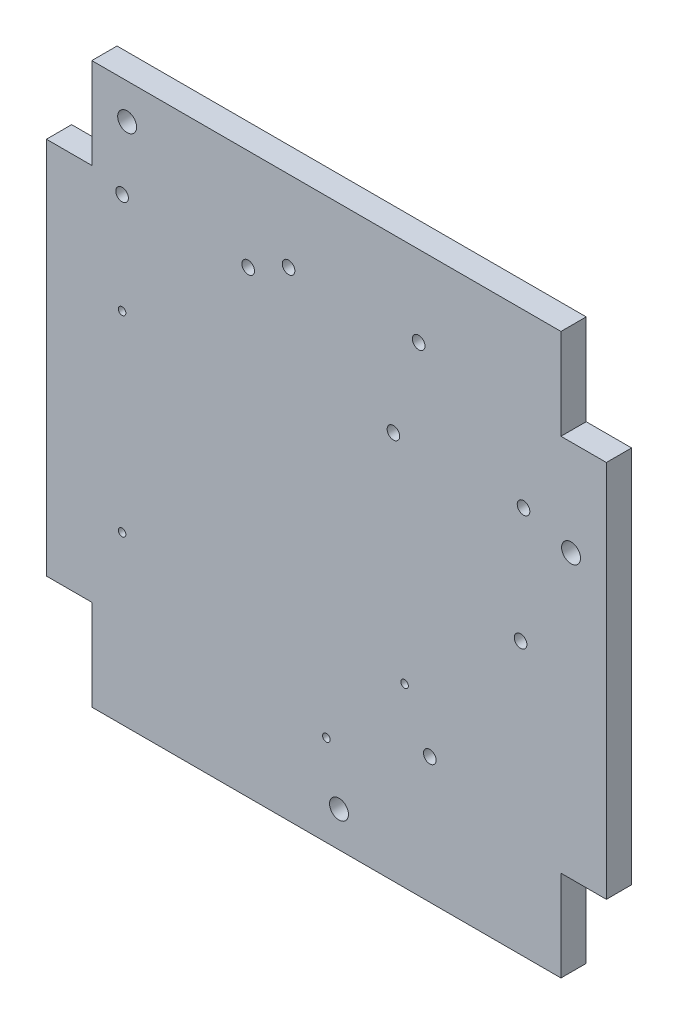
from build123d import *

# Parameters (mm, degrees)
SZKIC2_R                    = 0.75
SZKIC2_R_2                  = 1.875
SZKIC2_R_3                  = 1.25
DODANIE_WYCI_GNI_CIE1_DEPTH = 5


with BuildPart() as part:
    # Szkic2 → Dodanie-wyciągnięcie1 (new body)
    with BuildSketch(Plane.XY):
        Polygon((9, 18), (9, 0), (102, 0), (102, 18), (111, 18), (111, 93), (102, 93), (102, 111), (9, 111), (9, 93), (0, 93), (0, 18), align=None)
        with Locations((15, 33)):
            Circle(SZKIC2_R, mode=Mode.SUBTRACT)
        with Locations((58, 7)):
            Circle(SZKIC2_R_2, mode=Mode.SUBTRACT)
        with Locations((55.5, 18)):
            Circle(SZKIC2_R, mode=Mode.SUBTRACT)
        with Locations((76, 25)):
            Circle(SZKIC2_R_3, mode=Mode.SUBTRACT)
        with Locations((71, 35)):
            Circle(SZKIC2_R, mode=Mode.SUBTRACT)
        with Locations((94, 53.844410204)):
            Circle(SZKIC2_R_3, mode=Mode.SUBTRACT)
        with Locations((15, 71)):
            Circle(SZKIC2_R, mode=Mode.SUBTRACT)
        with Locations((15, 91)):
            Circle(SZKIC2_R_3, mode=Mode.SUBTRACT)
        with Locations((16, 104)):
            Circle(SZKIC2_R_2, mode=Mode.SUBTRACT)
        with Locations((40, 91)):
            Circle(SZKIC2_R_3, mode=Mode.SUBTRACT)
        with Locations((48, 95)):
            Circle(SZKIC2_R_3, mode=Mode.SUBTRACT)
        with Locations((68.790622886, 77)):
            Circle(SZKIC2_R_3, mode=Mode.SUBTRACT)
        with Locations((94.581245773, 77)):
            Circle(SZKIC2_R_3, mode=Mode.SUBTRACT)
        with Locations((104, 74)):
            Circle(SZKIC2_R_2, mode=Mode.SUBTRACT)
        with Locations((73.790622886, 95)):
            Circle(SZKIC2_R_3, mode=Mode.SUBTRACT)
    extrude(amount=DODANIE_WYCI_GNI_CIE1_DEPTH)


solid = part.part
